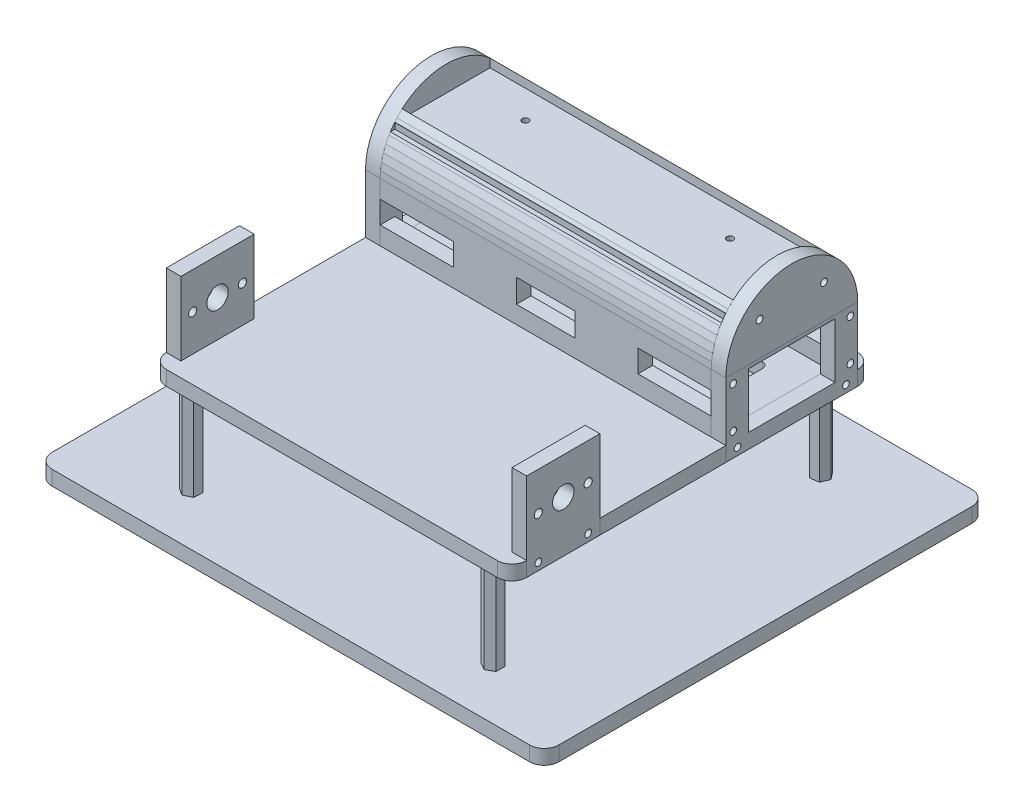
from build123d import *

# Parameters (mm, degrees)
RESSALTO_EXTRUS_O1_DEPTH         = 5
ESBO_O2_W                        = 5
ESBO_O2_H                        = 25
CORTE_EXTRUS_O1_DEPTH            = 5
ESBO_O7_W                        = 5
ESBO_O7_H                        = 45
CORTE_EXTRUS_O4_DEPTH            = 5
RESSALTO_EXTRUS_O4_DEPTH         = 20
RESSALTO_EXTRUS_O4_DEPTH_BACK    = 5
ESBO_O11_W                       = 5
ESBO_O11_H                       = 45
RESSALTO_EXTRUS_O4_2_DEPTH       = 20
RESSALTO_EXTRUS_O4_2_DEPTH_BACK  = 5
RESSALTO_EXTRUS_O5_DEPTH         = 5
RESSALTO_EXTRUS_O6_DEPTH         = 5
ESBO_O18_W                       = 113
ESBO_O18_H                       = 5
RESSALTO_EXTRUS_O8_DEPTH         = 20
RESSALTO_EXTRUS_O8_2_DEPTH       = 20
RESSALTO_EXTRUS_O9_DEPTH         = 113
RESSALTO_EXTRUS_O10_DEPTH        = 113
ESBO_O23_W                       = 35
ESBO_O23_H                       = 5
RESSALTO_EXTRUS_O12_DEPTH        = 113
ESBO_O24_W                       = 25
ESBO_O24_H                       = 7.619999999
CORTE_EXTRUS_O5_DEPTH            = 5
ESBO_O25_W                       = 25
ESBO_O25_H                       = 7.62
CORTE_EXTRUS_O6_DEPTH            = 5
ESBO_O26_R                       = 1.15
CORTE_EXTRUS_O8_DEPTH            = 5
ESBO_O27_R                       = 1.15
CORTE_EXTRUS_O9_DEPTH            = 5
ESBO_O28_W                       = 20
ESBO_O28_H                       = 8
CORTE_EXTRUS_O10_DEPTH           = 5
RESSALTO_EXTRUS_O13_DEPTH        = 25
RESSALTO_EXTRUS_O13_DEPTH_BACK   = 5
ESBO_O30_W                       = 5
ESBO_O30_H                       = 25
RESSALTO_EXTRUS_O13_2_DEPTH      = 25
RESSALTO_EXTRUS_O13_2_DEPTH_BACK = 5
ESBO_O31_R                       = 1.15
ESBO_O31_R_2                     = 3.65
ESBO_O31_R_3                     = 1.4
CORTE_EXTRUS_O14_DEPTH           = 5
ESBO_O32_R                       = 1.15
ESBO_O32_R_2                     = 3.65
ESBO_O32_R_3                     = 1.4
CORTE_EXTRUS_O15_DEPTH           = 5
CORTE_EXTRUS_O16_DEPTH           = 5
ESBO_O35_W                       = 29.59
ESBO_O35_H                       = 18.85
CORTE_EXTRUS_O18_DEPTH           = 5
ESBO_O36_W                       = 29.59
ESBO_O36_H                       = 18.85
CORTE_EXTRUS_O19_DEPTH           = 5
ESBO_O37_R                       = 1.1
CORTE_EXTRUS_O20_DEPTH           = 5
RESSALTO_EXTRUS_O14_DEPTH        = 30
RESSALTO_EXTRUS_O14_2_DEPTH      = 30
RESSALTO_EXTRUS_O14_3_DEPTH      = 30
RESSALTO_EXTRUS_O14_4_DEPTH      = 30
RESSALTO_EXTRUS_O15_DEPTH        = 5
ESBO_O41_R                       = 1.6
CORTE_EXTRUS_O21_DEPTH           = 5
RESSALTO_EXTRUS_O16_DEPTH        = 113
RESSALTO_EXTRUS_O17_DEPTH        = 113


with BuildPart() as part:
    # Esboço1 → Ressalto-extrusão1 (new body)
    with BuildSketch(Plane(origin=(0, 0, 0), x_dir=(1, 0, 0), z_dir=(0, 1, 0))):
        with BuildLine():
            Line((-20.688948469, 116.486662709), (92.311051531, 116.486662709))
            ThreePointArc((92.311051531, 116.486662709), (95.846585437, 115.022196615), (97.311051531, 111.486662709))
            Line((97.311051531, 111.486662709), (97.311051531, -1.513337291))
            ThreePointArc((97.311051531, -1.513337291), (95.846585437, -5.048871197), (92.311051531, -6.513337291))
            Line((92.311051531, -6.513337291), (-20.688948469, -6.513337291))
            ThreePointArc((-20.688948469, -6.513337291), (-24.224482375, -5.048871197), (-25.688948469, -1.513337291))
            Line((-25.688948469, -1.513337291), (-25.688948469, 111.486662709))
            ThreePointArc((-25.688948469, 111.486662709), (-24.224482375, 115.022196615), (-20.688948469, 116.486662709))
        make_face()
    extrude(amount=RESSALTO_EXTRUS_O1_DEPTH)

    # Esboço2 → Corte-extrusão1 (cut)
    with BuildSketch(Plane(origin=(0, 5, 0), x_dir=(1, 0, 0), z_dir=(0, 1, 0))):
        with Locations((94.811051531, 10.986662709)):
            Rectangle(ESBO_O2_W, ESBO_O2_H)
        with Locations((-23.188948469, 10.986662709)):
            Rectangle(ESBO_O2_W, ESBO_O2_H)
    extrude(amount=-CORTE_EXTRUS_O1_DEPTH, mode=Mode.SUBTRACT)

    # Esboço7 → Corte-extrusão4 (cut)
    with BuildSketch(Plane(origin=(0, 5, 0), x_dir=(1, 0, 0), z_dir=(0, 1, 0))):
        with Locations((94.811051531, 88.986662709)):
            Rectangle(ESBO_O7_W, ESBO_O7_H)
        with Locations((-23.188948469, 88.986662709)):
            Rectangle(ESBO_O7_W, ESBO_O7_H)
    extrude(amount=-CORTE_EXTRUS_O4_DEPTH, mode=Mode.SUBTRACT)

    # Esboço33 → Corte-extrusão16 (cut)
    with BuildSketch(Plane.XZ):
        with BuildLine():
            Line((78.811051531, -97.486662709), (-7.188948469, -97.486662709))
            ThreePointArc((-7.188948469, -97.486662709), (-8.603162031, -96.900876271), (-9.188948469, -95.486662709))
            Line((-9.188948469, -95.486662709), (-9.188948469, -83.486662709))
            ThreePointArc((-9.188948469, -83.486662709), (-8.603162031, -82.072449147), (-7.188948469, -81.486662709))
            Line((-7.188948469, -81.486662709), (78.811051531, -81.486662709))
            ThreePointArc((78.811051531, -81.486662709), (80.225265093, -82.072449147), (80.811051531, -83.486662709))
            Line((80.811051531, -83.486662709), (80.811051531, -95.486662709))
            ThreePointArc((80.811051531, -95.486662709), (80.225265093, -96.900876271), (78.811051531, -97.486662709))
        make_face()
    extrude(amount=-CORTE_EXTRUS_O16_DEPTH, mode=Mode.SUBTRACT)


with BuildPart() as body_2:
    # Esboço11 → Ressalto-extrusão4 (new, two sides: drawn at the far end of the back side and taken through both)
    with BuildSketch(Plane(origin=(0, 5, 0), x_dir=(1, 0, 0), z_dir=(0, 1, 0)).offset(-RESSALTO_EXTRUS_O4_DEPTH_BACK)):
        with Locations((94.811051531, 88.986662709)):
            Rectangle(ESBO_O11_W, ESBO_O11_H)
    extrude(amount=RESSALTO_EXTRUS_O4_DEPTH + RESSALTO_EXTRUS_O4_DEPTH_BACK)


with BuildPart() as body_3:
    # Esboço11 → Ressalto-extrus_o4 2 (new, two sides: drawn at the far end of the back side and taken through both)
    with BuildSketch(Plane(origin=(0, 5, 0), x_dir=(1, 0, 0), z_dir=(0, 1, 0)).offset(-RESSALTO_EXTRUS_O4_2_DEPTH_BACK)):
        with Locations((-23.188948469, 88.986662709)):
            Rectangle(ESBO_O11_W, ESBO_O11_H)
    extrude(amount=RESSALTO_EXTRUS_O4_2_DEPTH + RESSALTO_EXTRUS_O4_2_DEPTH_BACK)


with BuildPart() as body_4:
    # Esboço12 → Ressalto-extrusão5 (new body)
    with BuildSketch(Plane(origin=(97.311051531, 0, 0), x_dir=(0, 0, -1), z_dir=(1, 0, 0))):
        with BuildLine():
            Line((111.486662709, 25), (66.486662709, 25))
            ThreePointArc((66.486662709, 25), (88.986662709, 47.5), (111.486662709, 25))
        make_face()
    extrude(amount=-RESSALTO_EXTRUS_O5_DEPTH)


with BuildPart() as body_5:
    # Esboço14 → Ressalto-extrusão6 (new body)
    with BuildSketch(Plane.ZY.offset(25.688948469)):
        with BuildLine():
            Line((-66.486662709, 25), (-111.486662709, 25))
            ThreePointArc((-111.486662709, 25), (-88.986662709, 47.5), (-66.486662709, 25))
        make_face()
    extrude(amount=-RESSALTO_EXTRUS_O6_DEPTH)


with BuildPart() as body_6:
    # Esboço18 → Ressalto-extrusão8 (new body)
    with BuildSketch(Plane(origin=(0, 5, 0), x_dir=(1, 0, 0), z_dir=(0, 1, 0))):
        with Locations((35.811051531, 108.986662709)):
            Rectangle(ESBO_O18_W, ESBO_O18_H)
    extrude(amount=RESSALTO_EXTRUS_O8_DEPTH)

    # Esboço24 → Corte-extrusão5 (cut)
    with BuildSketch(Plane(origin=(0, 0, -111.486662709), x_dir=(-1, 0, 0), z_dir=(0, 0, -1))):
        with Locations((8.188948469, 15)):
            Rectangle(ESBO_O24_W, ESBO_O24_H)
        with Locations((-79.811051531, 15)):
            Rectangle(ESBO_O24_W, ESBO_O24_H)
    extrude(amount=-CORTE_EXTRUS_O5_DEPTH, mode=Mode.SUBTRACT)

    # Esboço41 → Corte-extrusão21 (cut)
    with BuildSketch(Plane(origin=(0, 0, -111.486662709), x_dir=(-1, 0, 0), z_dir=(0, 0, -1))):
        with Locations((-17.141051531, 20)):
            Circle(ESBO_O41_R)
        with Locations((-54.481051531, 20)):
            Circle(ESBO_O41_R)
    extrude(amount=-CORTE_EXTRUS_O21_DEPTH, mode=Mode.SUBTRACT)


with BuildPart() as body_7:
    # Esboço18 → Ressalto-extrus_o8 2 (new body)
    with BuildSketch(Plane(origin=(0, 5, 0), x_dir=(1, 0, 0), z_dir=(0, 1, 0))):
        with Locations((35.811051531, 68.986662709)):
            Rectangle(ESBO_O18_W, ESBO_O18_H)
    extrude(amount=RESSALTO_EXTRUS_O8_2_DEPTH)

    # Esboço25 → Corte-extrusão6 (cut)
    with BuildSketch(Plane.XY.offset(-66.486662709)):
        with Locations((-8.188948469, 15)):
            Rectangle(ESBO_O25_W, ESBO_O25_H)
        with Locations((79.811051531, 15)):
            Rectangle(ESBO_O25_W, ESBO_O25_H)
    extrude(amount=-CORTE_EXTRUS_O6_DEPTH, mode=Mode.SUBTRACT)

    # Esboço28 → Corte-extrusão10 (cut)
    with BuildSketch(Plane.XY.offset(-66.486662709)):
        with Locations((35.811051531, 15)):
            Rectangle(ESBO_O28_W, ESBO_O28_H)
    extrude(amount=-CORTE_EXTRUS_O10_DEPTH, mode=Mode.SUBTRACT)


with BuildPart() as body_8:
    # Esboço19 → Ressalto-extrusão9 (new body)
    with BuildSketch(Plane(origin=(-20.688948469, 0, 0), x_dir=(0, 0, -1), z_dir=(1, 0, 0))):
        Polygon((71.486662709, 25), (71.486662709, 37), (69.987760034, 37), (69.499997179, 36.248105018), (68.435661871, 34.160041733), (67.598358488, 31.985015573), (66.942866972, 29.507889696), (66.597394011, 27.229494828), (66.486662709, 25), align=None)
    extrude(amount=RESSALTO_EXTRUS_O9_DEPTH)


with BuildPart() as body_9:
    # Esboço21 → Ressalto-extrusão10 (new body)
    with BuildSketch(Plane(origin=(-20.688948469, 0, 0), x_dir=(0, 0, -1), z_dir=(1, 0, 0))):
        Polygon((111.486662709, 25), (106.486662709, 25), (106.486662709, 37), (107.986019625, 37), (108.472388535, 36.249732843), (109.543616623, 34.146674027), (110.379154653, 31.972179604), (110.997562757, 29.665863164), (111.36316988, 27.354129737), align=None)
    extrude(amount=RESSALTO_EXTRUS_O10_DEPTH)


with BuildPart() as body_10:
    # Esboço23 → Ressalto-extrusão12 (new body)
    with BuildSketch(Plane(origin=(-20.688948469, 0, 0), x_dir=(0, 0, -1), z_dir=(1, 0, 0))):
        with Locations((88.986662709, 36.4)):
            Rectangle(ESBO_O23_W, ESBO_O23_H)
    extrude(amount=RESSALTO_EXTRUS_O12_DEPTH)

    # Esboço37 → Corte-extrusão20 (cut)
    with BuildSketch(Plane(origin=(0, 38.9, 0), x_dir=(1, 0, 0), z_dir=(0, 1, 0))):
        with Locations(Location((70.736051531, 94.486662709, 0), (0, 0, 270))):
            Circle(ESBO_O37_R)
        with Locations(Location((0.886051531, 94.486662709, 0), (0, 0, 270))):
            Circle(ESBO_O37_R)
    extrude(amount=-CORTE_EXTRUS_O20_DEPTH, mode=Mode.SUBTRACT)


with BuildPart() as corte_extrus_o8_tool:
    # Esboço26 → Corte-extrusão8 (new body)
    with BuildSketch(Plane.ZY.offset(25.688948469)):
        with Locations((-107.486662709, 2.5)):
            Circle(ESBO_O26_R)
        with Locations((-70.486662709, 2.5)):
            Circle(ESBO_O26_R)
        with Locations((-108.986662709, 8)):
            Circle(ESBO_O26_R)
        with Locations((-68.986662709, 8)):
            Circle(ESBO_O26_R)
        with Locations((-108.986662709, 22)):
            Circle(ESBO_O26_R)
        with Locations((-68.986662709, 22)):
            Circle(ESBO_O26_R)
        with Locations((-99.986662709, 36.5)):
            Circle(ESBO_O26_R)
        with Locations((-77.986662709, 36.5)):
            Circle(ESBO_O26_R)
    extrude(amount=-CORTE_EXTRUS_O8_DEPTH)


with BuildPart() as body_3_1:
    add(body_3.part)

    # Corte-extrusão8: cut by corte_extrus_o8_tool
    add(corte_extrus_o8_tool.part, mode=Mode.SUBTRACT)

    # Esboço36 → Corte-extrusão19 (cut)
    with BuildSketch(Plane.ZY.offset(25.688948469)):
        with Locations((-88.986662709, 14.425)):
            Rectangle(ESBO_O36_W, ESBO_O36_H)
    extrude(amount=-CORTE_EXTRUS_O19_DEPTH, mode=Mode.SUBTRACT)


with BuildPart() as body_5_1:
    add(body_5.part)

    # Corte-extrusão8: cut by corte_extrus_o8_tool
    add(corte_extrus_o8_tool.part, mode=Mode.SUBTRACT)


with BuildPart() as corte_extrus_o9_tool:
    # Esboço27 → Corte-extrusão9 (new body)
    with BuildSketch(Plane(origin=(97.311051531, 0, 0), x_dir=(0, 0, -1), z_dir=(1, 0, 0))):
        with Locations(Location((70.486662709, 2.5, 0), (0, 0, 180))):
            Circle(ESBO_O27_R)
        with Locations(Location((107.486662709, 2.5, 0), (0, 0, 180))):
            Circle(ESBO_O27_R)
        with Locations(Location((68.986662709, 8, 0), (0, 0, 180))):
            Circle(ESBO_O27_R)
        with Locations(Location((68.986662709, 22, 0), (0, 0, 180))):
            Circle(ESBO_O27_R)
        with Locations(Location((77.986662709, 36.5, 0), (0, 0, 180))):
            Circle(ESBO_O27_R)
        with Locations(Location((99.986662709, 36.5, 0), (0, 0, 180))):
            Circle(ESBO_O27_R)
        with Locations(Location((108.986662709, 22, 0), (0, 0, 180))):
            Circle(ESBO_O27_R)
        with Locations(Location((108.986662709, 8, 0), (0, 0, 180))):
            Circle(ESBO_O27_R)
    extrude(amount=-CORTE_EXTRUS_O9_DEPTH)


with BuildPart() as body_2_1:
    add(body_2.part)

    # Corte-extrusão9: cut by corte_extrus_o9_tool
    add(corte_extrus_o9_tool.part, mode=Mode.SUBTRACT)

    # Esboço35 → Corte-extrusão18 (cut)
    with BuildSketch(Plane(origin=(97.311051531, 0, 0), x_dir=(0, 0, -1), z_dir=(1, 0, 0))):
        with Locations((88.986662709, 14.425)):
            Rectangle(ESBO_O35_W, ESBO_O35_H)
    extrude(amount=-CORTE_EXTRUS_O18_DEPTH, mode=Mode.SUBTRACT)


with BuildPart() as body_4_1:
    add(body_4.part)

    # Corte-extrusão9: cut by corte_extrus_o9_tool
    add(corte_extrus_o9_tool.part, mode=Mode.SUBTRACT)


with BuildPart() as body_11:
    # Esboço30 → Ressalto-extrusão13 (new, two sides: drawn at the far end of the back side and taken through both)
    with BuildSketch(Plane(origin=(0, 5, 0), x_dir=(1, 0, 0), z_dir=(0, 1, 0)).offset(-RESSALTO_EXTRUS_O13_DEPTH_BACK)):
        with Locations((94.811051531, 10.986662709)):
            Rectangle(ESBO_O30_W, ESBO_O30_H)
    extrude(amount=RESSALTO_EXTRUS_O13_DEPTH + RESSALTO_EXTRUS_O13_DEPTH_BACK)

    # Esboço32 → Corte-extrusão15 (cut)
    with BuildSketch(Plane(origin=(97.311051531, 0, 0), x_dir=(0, 0, -1), z_dir=(1, 0, 0))):
        with Locations(Location((2.486662709, 2.5, 0), (0, 0, 180))):
            Circle(ESBO_O32_R)
        with Locations(Location((19.486662709, 2.5, 0), (0, 0, 180))):
            Circle(ESBO_O32_R)
        with Locations(Location((10.986662709, 17.5, 0), (0, 0, 180))):
            Circle(ESBO_O32_R_2)
        with Locations((2.486662709, 16.907517934)):
            Circle(ESBO_O32_R_3)
        with Locations(Location((19.486662709, 17.5, 0), (0, 0, 180))):
            Circle(ESBO_O32_R_3)
    extrude(amount=-CORTE_EXTRUS_O15_DEPTH, mode=Mode.SUBTRACT)


with BuildPart() as body_12:
    # Esboço30 → Ressalto-extrus_o13 2 (new, two sides: drawn at the far end of the back side and taken through both)
    with BuildSketch(Plane(origin=(0, 5, 0), x_dir=(1, 0, 0), z_dir=(0, 1, 0)).offset(-RESSALTO_EXTRUS_O13_2_DEPTH_BACK)):
        with Locations((-23.188948469, 10.986662709)):
            Rectangle(ESBO_O30_W, ESBO_O30_H)
    extrude(amount=RESSALTO_EXTRUS_O13_2_DEPTH + RESSALTO_EXTRUS_O13_2_DEPTH_BACK)

    # Esboço31 → Corte-extrusão14 (cut)
    with BuildSketch(Plane.ZY.offset(25.688948469)):
        with Locations((-19.486662709, 2.5)):
            Circle(ESBO_O31_R)
        with Locations((-2.486662709, 2.5)):
            Circle(ESBO_O31_R)
        with Locations((-10.986662709, 17.5)):
            Circle(ESBO_O31_R_2)
        with Locations((-19.486662709, 17.5)):
            Circle(ESBO_O31_R_3)
        with Locations((-2.486662709, 17.5)):
            Circle(ESBO_O31_R_3)
    extrude(amount=-CORTE_EXTRUS_O14_DEPTH, mode=Mode.SUBTRACT)


with BuildPart() as body_13:
    # Esboço38 → Ressalto-extrusão14 (new body)
    with BuildSketch(Plane(origin=(0, 0, 0), x_dir=(-1, 0, 0), z_dir=(0, -1, 0))):
        Polygon((-87.311051531, -0.013337291), (-89.909127742, -1.513337291), (-89.909127742, -4.513337291), (-87.311051531, -6.013337291), (-84.71297532, -4.513337291), (-84.71297532, -1.513337291), align=None)
    extrude(amount=RESSALTO_EXTRUS_O14_DEPTH)


with BuildPart() as body_14:
    # Esboço38 → Ressalto-extrus_o14 2 (new body)
    with BuildSketch(Plane(origin=(0, 0, 0), x_dir=(-1, 0, 0), z_dir=(0, -1, 0))):
        Polygon((13.009670435, -1.663719116), (13.180505827, -4.658851044), (15.859783861, -6.008469219), (18.368226502, -4.362955466), (18.197391111, -1.367823538), (15.518113077, -0.018205363), align=None)
    extrude(amount=RESSALTO_EXTRUS_O14_2_DEPTH)


with BuildPart() as body_15:
    # Esboço38 → Ressalto-extrus_o14 3 (new body)
    with BuildSketch(Plane(origin=(0, 0, 0), x_dir=(-1, 0, 0), z_dir=(0, -1, 0))):
        Polygon((13.234443248, 110.711598684), (12.967857484, 107.723466821), (15.422362705, 105.998530846), (18.14345369, 107.261726734), (18.410039454, 110.249858597), (15.955534233, 111.974794572), align=None)
    extrude(amount=RESSALTO_EXTRUS_O14_3_DEPTH)


with BuildPart() as body_16:
    # Esboço38 → Ressalto-extrus_o14 4 (new body)
    with BuildSketch(Plane(origin=(0, 0, 0), x_dir=(-1, 0, 0), z_dir=(0, -1, 0))):
        Polygon((-88.440937319, 111.765755745), (-90.282759594, 109.397699431), (-89.152873806, 106.618606395), (-86.181165743, 106.207569673), (-84.339343468, 108.575625987), (-85.469229256, 111.354719023), align=None)
    extrude(amount=RESSALTO_EXTRUS_O14_4_DEPTH)


with BuildPart() as body_17:
    # Esboço39 → Ressalto-extrusão15 (new body)
    with BuildSketch(Plane.XZ.offset(30)):
        with BuildLine():
            Line((-45.688948469, -130.486662709), (117.311051531, -130.486662709))
            ThreePointArc((117.311051531, -130.486662709), (120.846585437, -129.022196615), (122.311051531, -125.486662709))
            Line((122.311051531, -125.486662709), (122.311051531, 15.513337291))
            ThreePointArc((122.311051531, 15.513337291), (120.846585437, 19.048871197), (117.311051531, 20.513337291))
            Line((117.311051531, 20.513337291), (-45.688948469, 20.513337291))
            ThreePointArc((-45.688948469, 20.513337291), (-49.224482375, 19.048871197), (-50.688948469, 15.513337291))
            Line((-50.688948469, 15.513337291), (-50.688948469, -125.486662709))
            ThreePointArc((-50.688948469, -125.486662709), (-49.224482375, -129.022196615), (-45.688948469, -130.486662709))
        make_face()
    extrude(amount=RESSALTO_EXTRUS_O15_DEPTH)


with BuildPart() as body_18:
    # Esboço42 → Ressalto-extrusão16 (new body)
    with BuildSketch(Plane(origin=(-20.688948469, 0, 0), x_dir=(0, 0, -1), z_dir=(1, 0, 0))):
        Polygon((71.486662709, 38.9), (71.486662709, 39.092817515), (72.216152878, 40), (73.986662709, 41.770509831), (73.986662709, 38.9), align=None)
    extrude(amount=RESSALTO_EXTRUS_O16_DEPTH)


with BuildPart() as body_19:
    # Esboço43 → Ressalto-extrusão17 (new body)
    with BuildSketch(Plane(origin=(-20.688948469, 0, 0), x_dir=(0, 0, -1), z_dir=(1, 0, 0))):
        Polygon((106.486662709, 38.9), (103.986662709, 38.9), (103.986662709, 41.770509831), (105.700934813, 40.062639478), (106.486662709, 39.086783658), align=None)
    extrude(amount=RESSALTO_EXTRUS_O17_DEPTH)


solid = Compound([part.part, body_6.part, body_7.part, body_8.part, body_9.part, body_10.part, body_3_1.part, body_5_1.part, body_2_1.part, body_4_1.part, body_11.part, body_12.part, body_13.part, body_14.part, body_15.part, body_16.part, body_17.part, body_18.part, body_19.part])
